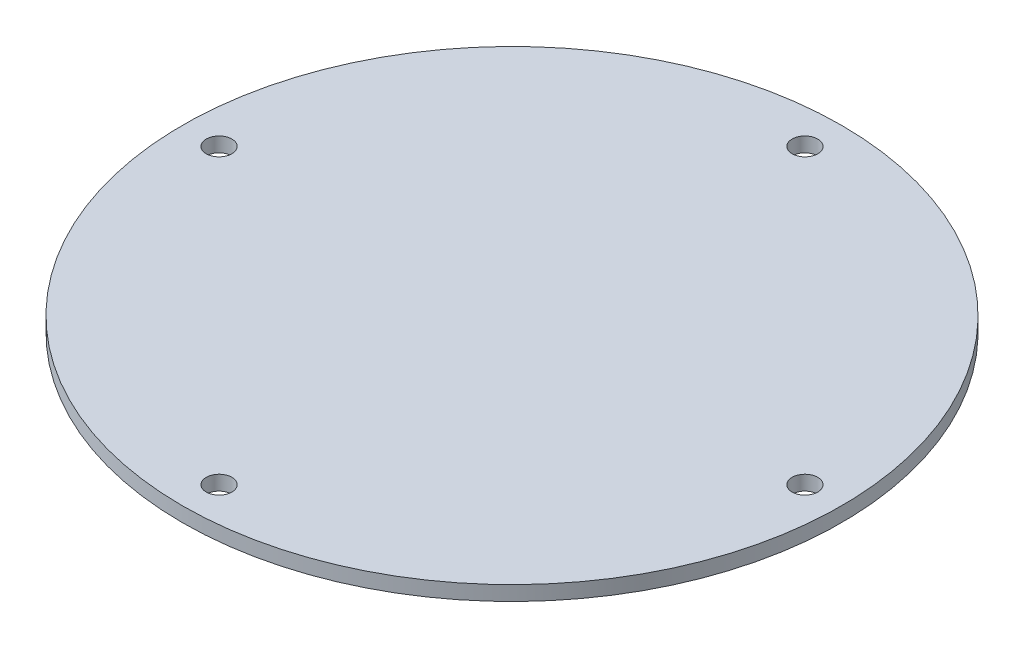
from build123d import *

# Parameters (mm, degrees)
SKETCH1_R           = 45
BOSS_EXTRUDE1_DEPTH = 2
SKETCH2_R           = 1.75
CUT_EXTRUDE1_DEPTH  = 64.671029519


with BuildPart() as part:
    # Sketch1 → Boss-Extrude1 (new body)
    with BuildSketch(Plane(origin=(0, 0, 0), x_dir=(1, 0, 0), z_dir=(0, 1, 0))):
        with Locations(Location((0, 0, 0), (0, 0, 270))):
            Circle(SKETCH1_R)
    extrude(amount=BOSS_EXTRUDE1_DEPTH)

    # Sketch2 → Cut-Extrude1 (cut, through all)
    with BuildSketch(Plane(origin=(0, 2, 0), x_dir=(1, 0, 0), z_dir=(0, 1, 0))):
        with Locations(Location((0, 40, 0), (0, 0, 270))):
            Circle(SKETCH2_R)
        with Locations(Location((40, 0, 0), (0, 0, 270))):
            Circle(SKETCH2_R)
        with Locations(Location((0, -40, 0), (0, 0, 270))):
            Circle(SKETCH2_R)
        with Locations(Location((-40, 0, 0), (0, 0, 270))):
            Circle(SKETCH2_R)
    extrude(amount=-CUT_EXTRUDE1_DEPTH, mode=Mode.SUBTRACT)


solid = part.part
